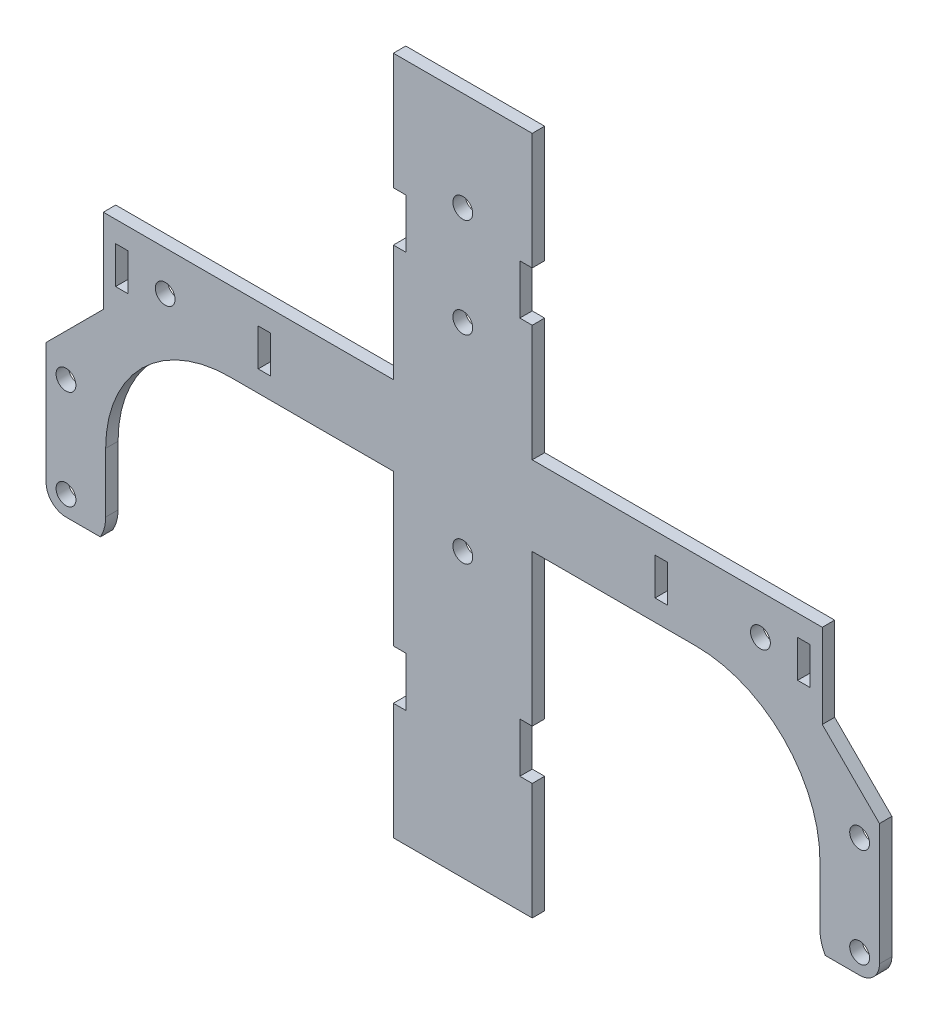
from build123d import *

# Parameters (mm, degrees)
SKETCH1_R           = 4
BOSS_EXTRUDE1_DEPTH = 2.5
SKETCH2_R           = 4
BOSS_EXTRUDE2_DEPTH = 2.5
SKETCH3_W           = 5
SKETCH3_H           = 15
CUT_EXTRUDE1_DEPTH  = 5


with BuildPart() as part:
    # Sketch1 → Boss-Extrude1 (new, symmetric)
    with BuildSketch(Plane.XY):
        Polygon((28, 137), (-28, 137), (-28, 90), (-23, 90), (-23, 70), (-28, 70), (-28, -70), (-23, -70), (-23, -90), (-28, -90), (-28, -137), (28, -137), (28, -90), (23, -90), (23, -70), (28, -70), (28, 70), (23, 70), (23, 90), (28, 90), align=None)
        with Locations((0, -23)):
            Circle(SKETCH1_R, mode=Mode.SUBTRACT)
        with Locations((0, 57)):
            Circle(SKETCH1_R, mode=Mode.SUBTRACT)
        with Locations((0, 97)):
            Circle(SKETCH1_R, mode=Mode.SUBTRACT)
    extrude(amount=BOSS_EXTRUDE1_DEPTH, both=True)

    # Sketch2 → Boss-Extrude2 (add, symmetric)
    with BuildSketch(Plane.XY):
        with BuildLine():
            Line((144, -59), (144, -83))
            ThreePointArc((144, -83), (160, -99), (176, -83))
            Line((176, -83), (176, 23))
            Line((176, 23), (120, 23))
            Line((120, 23), (28, 23))
            Line((28, 23), (28, -9))
            Line((28, -9), (94, -9))
            ThreePointArc((94, -9), (129.355339059, -23.644660941), (144, -59))
        make_face()
        with Locations((120, 7)):
            Circle(SKETCH2_R, mode=Mode.SUBTRACT)
        with Locations((160, -43)):
            Circle(SKETCH2_R, mode=Mode.SUBTRACT)
        with Locations((160, -83)):
            Circle(SKETCH2_R, mode=Mode.SUBTRACT)
    extrude(amount=BOSS_EXTRUDE2_DEPTH, both=True)

    # Sketch3 → Cut-Extrude1 (cut)
    with BuildSketch(Plane.XY.offset(2.5)):
        with BuildLine():
            ThreePointArc((168, -83), (165.656854249, -88.656854249), (160, -91))
            Line((160, -91), (146.143593539, -91))
            ThreePointArc((146.143593539, -91), (164.141104722, -98.454813221), (176, -83))
            Line((176, -83), (176, 23))
            Line((176, 23), (144.94116403, 23))
            Line((144.94116403, 23), (144.94116403, -10.94116403))
            Line((144.94116403, -10.94116403), (168, -34))
            Line((168, -34), (168, -83))
        make_face()
        with Locations((137.5, 7)):
            Rectangle(SKETCH3_W, SKETCH3_H)
        with Locations((80, 7)):
            Rectangle(SKETCH3_W, SKETCH3_H)
    extrude(amount=-CUT_EXTRUDE1_DEPTH, mode=Mode.SUBTRACT)

    # Mirror2: part across plane


with BuildPart() as part_1:
    add(part.part)
    add(part.part.mirror(Plane(origin=(0, 0, 0), x_dir=(0, 0, 1), z_dir=(1, 0, 0))))


solid = part_1.part
